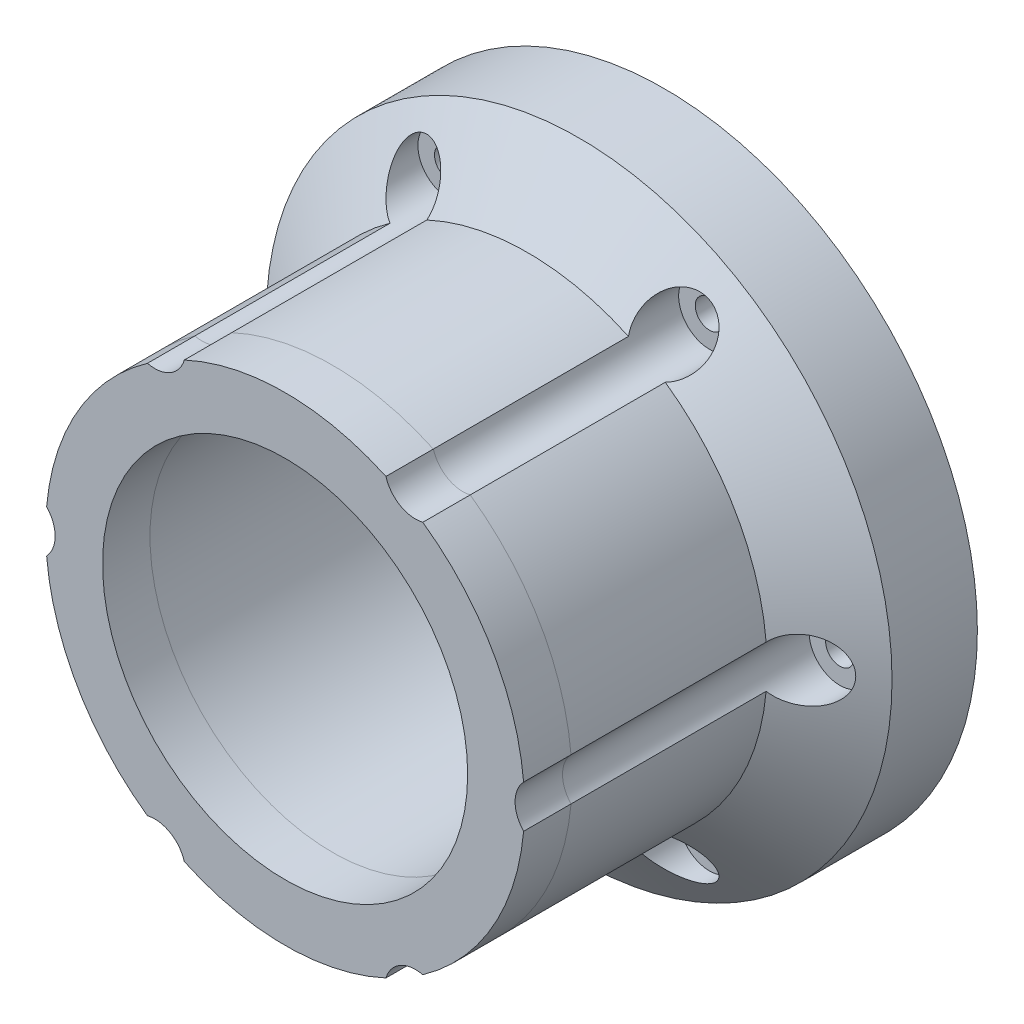
from build123d import *

# Parameters (mm, degrees)
SKETCH1_R           = 33
SKETCH1_R_2         = 19.25
SKETCH1_R_3         = 1.5
BOSS_EXTRUDE1_DEPTH = 35
SKETCH4_R           = 30
SKETCH4_R_2         = 22.25
CUT_EXTRUDE1_DEPTH  = 5
CUT_EXTRUDE2_START  = -26
SKETCH5_R           = 3.25
SKETCH5_R_2         = 1.5
CUT_EXTRUDE2_DEPTH  = 26
SKETCH7_R           = 19.25
SHIM_FEATURE_DEPTH  = 5
SKETCH9_W           = 7
SKETCH9_H           = 6.869534375
CUT_EXTRUDE5_DEPTH  = 5


with BuildPart() as part:
    # Sketch1 → Boss-Extrude1 (new body)
    with BuildSketch(Plane.XY):
        Circle(SKETCH1_R)
        Circle(SKETCH1_R_2, mode=Mode.SUBTRACT)
        with Locations((-27.5, 0)):
            Circle(SKETCH1_R_3, mode=Mode.SUBTRACT)
        with Locations((-13.75, 23.815698604)):
            Circle(SKETCH1_R_3, mode=Mode.SUBTRACT)
        with Locations((13.75, 23.815698604)):
            Circle(SKETCH1_R_3, mode=Mode.SUBTRACT)
        with Locations((27.5, 0)):
            Circle(SKETCH1_R_3, mode=Mode.SUBTRACT)
        with Locations((13.75, -23.815698604)):
            Circle(SKETCH1_R_3, mode=Mode.SUBTRACT)
        with Locations((-13.75, -23.815698604)):
            Circle(SKETCH1_R_3, mode=Mode.SUBTRACT)
    extrude(amount=BOSS_EXTRUDE1_DEPTH)

    # Sketch6 → Cut-Revolve1 (revolve, cut)
    with BuildSketch(Plane(origin=(0, 0, 0), x_dir=(0, 0, -1), z_dir=(1, 0, 0)), mode=Mode.PRIVATE) as cut_revolve1_sk:
        Polygon((-35, 33), (-9, 33), (-14.426608421, 25.25), (-35, 25.25), align=None)
    revolve(cut_revolve1_sk.sketch.rotate(Axis((0, 0, 0), (0, 0, 1)), 90), axis=Axis((0, 0, 0), (0, 0, 1)), mode=Mode.SUBTRACT)

    # Sketch4 → Cut-Extrude1 (cut)
    with BuildSketch(Plane(origin=(0, 0, 0), x_dir=(-1, 0, 0), z_dir=(0, 0, -1))):
        Circle(SKETCH4_R)
        Circle(SKETCH4_R_2, mode=Mode.SUBTRACT)
    extrude(amount=-CUT_EXTRUDE1_DEPTH, mode=Mode.SUBTRACT)

    # Sketch5 → Cut-Extrude2 (cut)
    # profile 1 of 6: a face of its own
    with BuildSketch(Plane.XY.offset(35).offset(CUT_EXTRUDE2_START)):
        with Locations((-13.75, 23.815698604)):
            Circle(SKETCH5_R)
        with Locations(Location((-13.75, 23.815698604, 0), (0, 0, 180))):
            Circle(SKETCH5_R_2, mode=Mode.SUBTRACT)
    # profile 2 of 6: a face of its own
    with BuildSketch(Plane.XY.offset(35).offset(CUT_EXTRUDE2_START)):
        with Locations((-27.5, 0)):
            Circle(SKETCH5_R)
        with Locations(Location((-27.5, 0, 0), (0, 0, 180))):
            Circle(SKETCH5_R_2, mode=Mode.SUBTRACT)
    # profile 3 of 6: a face of its own
    with BuildSketch(Plane.XY.offset(35).offset(CUT_EXTRUDE2_START)):
        with Locations((-13.75, -23.815698604)):
            Circle(SKETCH5_R)
        with Locations(Location((-13.75, -23.815698604, 0), (0, 0, 180))):
            Circle(SKETCH5_R_2, mode=Mode.SUBTRACT)
    # profile 4 of 6: a face of its own
    with BuildSketch(Plane.XY.offset(35).offset(CUT_EXTRUDE2_START)):
        with Locations((13.75, -23.815698604)):
            Circle(SKETCH5_R)
        with Locations(Location((13.75, -23.815698604, 0), (0, 0, 180))):
            Circle(SKETCH5_R_2, mode=Mode.SUBTRACT)
    # profile 5 of 6: a face of its own
    with BuildSketch(Plane.XY.offset(35).offset(CUT_EXTRUDE2_START)):
        with Locations((27.5, 0)):
            Circle(SKETCH5_R)
        with Locations(Location((27.5, 0, 0), (0, 0, 180))):
            Circle(SKETCH5_R_2, mode=Mode.SUBTRACT)
    # profile 6 of 6: a face of its own
    with BuildSketch(Plane.XY.offset(35).offset(CUT_EXTRUDE2_START)):
        with Locations((13.75, 23.815698604)):
            Circle(SKETCH5_R)
        with Locations(Location((13.75, 23.815698604, 0), (0, 0, 180))):
            Circle(SKETCH5_R_2, mode=Mode.SUBTRACT)
    extrude(amount=CUT_EXTRUDE2_DEPTH, mode=Mode.SUBTRACT)

    # Sketch9 → Cut-Extrude5 (cut)
    with BuildSketch(Plane(origin=(0, 0, 0), x_dir=(-1, 0, 0), z_dir=(0, 0, -1))):
        with Locations((0, -29.565232812)):
            Rectangle(SKETCH9_W, SKETCH9_H)
    extrude(amount=-CUT_EXTRUDE5_DEPTH, mode=Mode.SUBTRACT)


with BuildPart() as body_2:
    # Sketch7 → Shim-Feature (new body)
    with BuildSketch(Plane.XY.offset(35)):
        with BuildLine():
            ThreePointArc((10.63077779, 22.903036121), (12.125, 21.001116042), (14.51922221, 20.658041689))
            ThreePointArc((14.51922221, 20.658041689), (21.867141446, 12.625), (25.15, 2.244994432))
            ThreePointArc((25.15, 2.244994432), (24.25, 0), (25.15, -2.244994432))
            ThreePointArc((25.15, -2.244994432), (21.867141446, -12.625), (14.51922221, -20.658041689))
            ThreePointArc((14.51922221, -20.658041689), (12.125, -21.001116042), (10.63077779, -22.903036121))
            ThreePointArc((10.63077779, -22.903036121), (0, -25.25), (-10.63077779, -22.903036121))
            ThreePointArc((-10.63077779, -22.903036121), (-12.125, -21.001116042), (-14.51922221, -20.658041689))
            ThreePointArc((-14.51922221, -20.658041689), (-21.867141446, -12.625), (-25.15, -2.244994432))
            ThreePointArc((-25.15, -2.244994432), (-24.25, 0), (-25.15, 2.244994432))
            ThreePointArc((-25.15, 2.244994432), (-21.867141446, 12.625), (-14.51922221, 20.658041689))
            ThreePointArc((-14.51922221, 20.658041689), (-12.125, 21.001116042), (-10.63077779, 22.903036121))
            ThreePointArc((-10.63077779, 22.903036121), (0, 25.25), (10.63077779, 22.903036121))
        make_face()
        Circle(SKETCH7_R, mode=Mode.SUBTRACT)
    extrude(amount=SHIM_FEATURE_DEPTH)


solid = Compound([part.part, body_2.part])
